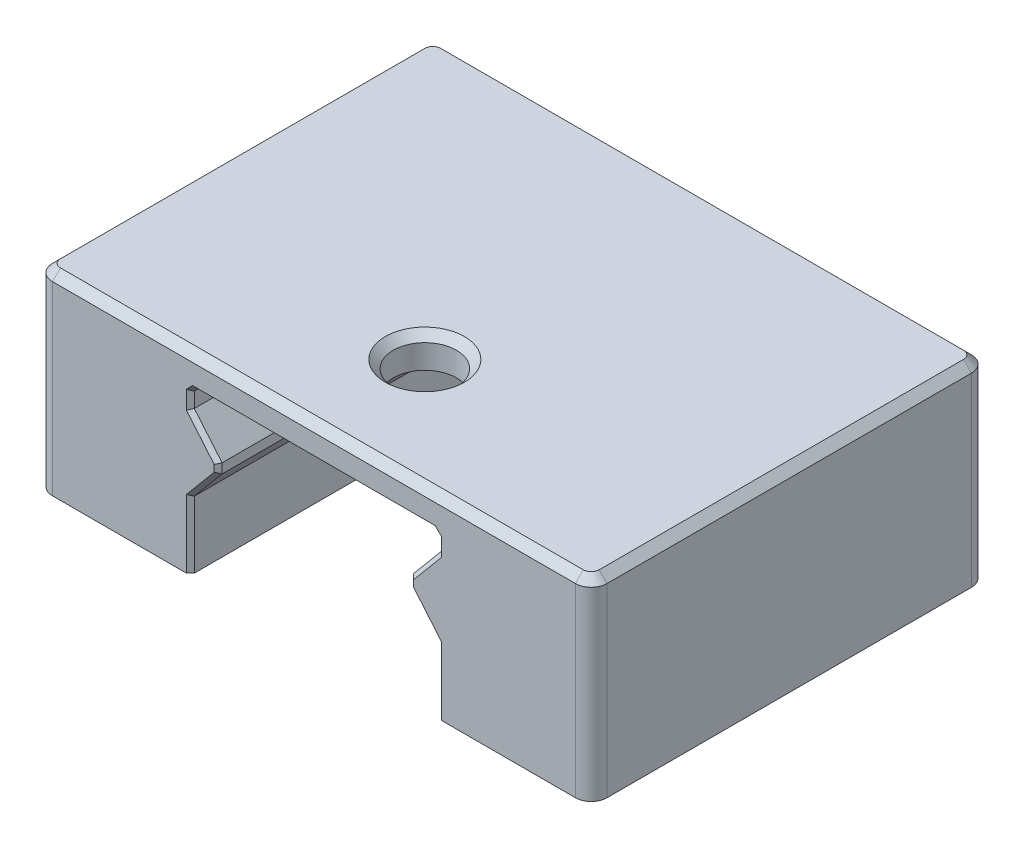
from build123d import *

# Parameters (mm, degrees)
P_IDAT_VYSUNUT_M1_DEPTH  = 25
SKICA2_R                 = 2
ODEBRAT_VYSUNUT_M1_DEPTH = 2.01
ZAOBLIT1_R               = 1
ZKOSEN_4_SIZE            = 0.25
ZKOSEN_5_SIZE            = 0.5
ZKOSEN_6_SIZE            = 0.5


with BuildPart() as part:
    # Skica1 → Přidat vysunutím1 (new body)
    with BuildSketch(Plane.XY):
        Polygon((0, 0), (0, 8), (35, 8), (35, 0), (35, -4.21), (25.3, -4.21), (25.3, 0), (23.546281771, 2.09), (23.546281771, 2.7), (25.3, 4.79), (25.3, 5.74), (25.05, 5.99), (9.95, 5.99), (9.7, 5.74), (9.7, 4.79), (11.453718229, 2.7), (11.453718229, 2.09), (9.7, 0), (9.7, -4.21), (0, -4.21), align=None)
    extrude(amount=P_IDAT_VYSUNUT_M1_DEPTH)

    # Skica2 → Odebrat vysunutím1 (cut)
    with BuildSketch(Plane(origin=(0, 8, 0), x_dir=(1, 0, 0), z_dir=(0, 1, 0))):
        with Locations(Location((17.5, -18, 0), (0, 0, 180))):
            Circle(SKICA2_R)
    extrude(amount=-ODEBRAT_VYSUNUT_M1_DEPTH, mode=Mode.SUBTRACT)

    # Zaoblit1
    zaoblit1_edges = [part.edges().sort_by_distance(p)[0] for p in [
        (0, 1.895, 0),
        (35, 1.895, 0),
        (0, 1.895, 25),
        (35, 1.895, 25),
    ]]
    fillet(zaoblit1_edges, radius=ZAOBLIT1_R)

    # Zkosení4
    zkosen_4_edges = [part.edges().sort_by_distance(p)[0] for p in [
        (9.7, -2.105, 25),
        (10.576859115, 1.045, 25),
        (11.453718229, 2.395, 25),
        (25.3, -2.105, 0),
        (24.423140885, 1.045, 0),
        (23.546281771, 2.395, 0),
        (24.423140885, 3.745, 0),
        (25.3, 5.265, 0),
        (25.175, 5.865, 0),
        (17.5, 5.99, 0),
        (9.825, 5.865, 0),
        (9.7, 5.265, 0),
        (10.576859115, 3.745, 25),
        (10.576859115, 3.745, 0),
        (11.453718229, 2.395, 0),
        (10.576859115, 1.045, 0),
        (9.7, -2.105, 0),
        (9.7, 5.265, 25),
        (9.825, 5.865, 25),
        (17.5, 5.99, 25),
        (25.175, 5.865, 25),
        (25.3, 5.265, 25),
        (24.423140885, 3.745, 25),
        (23.546281771, 2.395, 25),
        (24.423140885, 1.045, 25),
        (25.3, -2.105, 25),
    ]]
    chamfer(zkosen_4_edges, length=ZKOSEN_4_SIZE)

    # Zkosení5
    zkosen_5_edges = [part.edges().sort_by_distance(p)[0] for p in [
        (17.5, 8, 25),
        (17.5, 8, 0),
        (0, 8, 12.5),
        (35, 8, 12.5),
        (0.292893219, 8, 24.707106781),
        (0.292893219, 8, 0.292893219),
        (34.707106781, 8, 0.292893219),
        (34.707106781, 8, 24.707106781),
    ]]
    chamfer(zkosen_5_edges, length=ZKOSEN_5_SIZE)

    # Zkosení6
    zkosen_6_edges = [part.edges().sort_by_distance(p)[0] for p in [
        (19.5, 8, 18),
    ]]
    chamfer(zkosen_6_edges, length=ZKOSEN_6_SIZE)


solid = part.part
